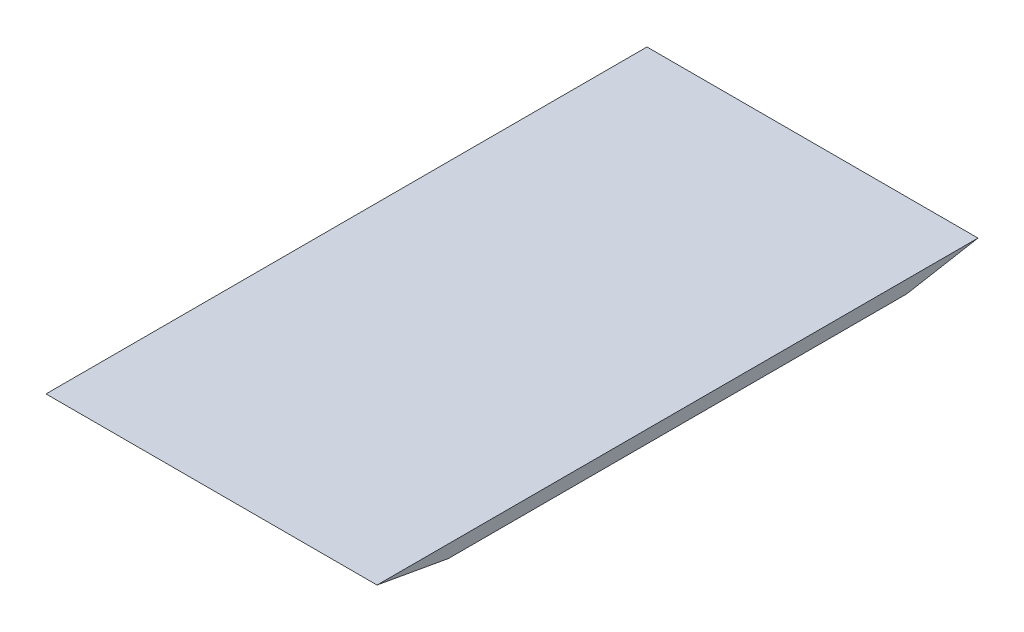
from build123d import *

# Parameters (mm, degrees)
BOSS_EXTRUDE1_DEPTH = 130


with BuildPart() as part:
    # Sketch1 → Boss-Extrude1 (new body)
    with BuildSketch(Plane(origin=(0, 0, 0), x_dir=(0, 0, -1), z_dir=(1, 0, 0))):
        Polygon((0, 0), (236, 0), (208, -5), (28, -5), align=None)
    extrude(amount=BOSS_EXTRUDE1_DEPTH)


solid = part.part
